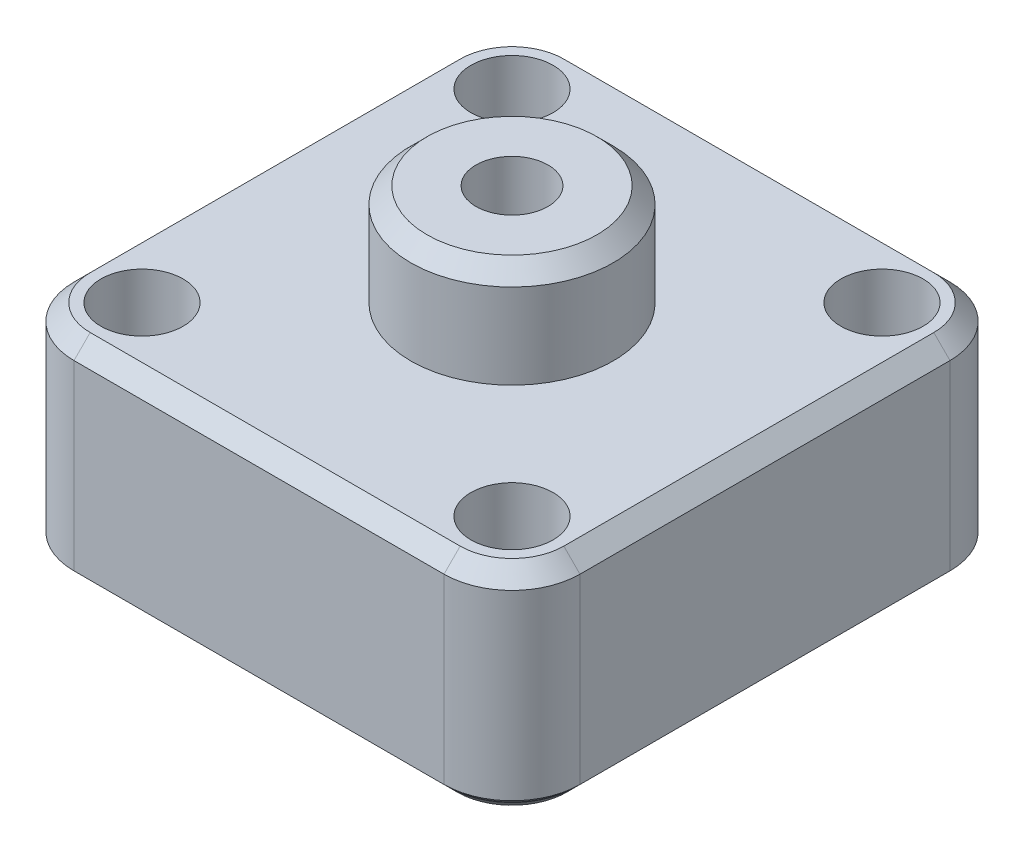
from build123d import *

# Parameters (mm, degrees)
SKETCH1_W             = 15.875
SKETCH1_H             = 15.875
BOSS_EXTRUDE1_DEPTH   = 9.525
F_5_40_TAPPED_HOLE1_D = 2.5781
SKETCH4_R             = 3.937
BOSS_EXTRUDE2_DEPTH   = 1.143
SKETCH10_R            = 1.9685
BOSS_EXTRUDE4_DEPTH   = 4.953
F_4_40_TAPPED_HOLE1_D = 2.2606
SKETCH9_OUTSIDE_W     = 23.345
SKETCH9_OUTSIDE_H     = 23.345
SKETCH9_OUTSIDE_R     = 3.175
CUT_EXTRUDE3_DEPTH    = 3.175
SKETCH11_OUTSIDE_W    = 23.345
SKETCH11_OUTSIDE_H    = 23.345
CUT_EXTRUDE4_DEPTH    = 15.721869362
CHAMFER1_SIZE         = 0.254
CHAMFER3_SIZE         = 0.508
CHAMFER4_SIZE         = 0.127


with BuildPart() as part:
    # Sketch1 → Boss-Extrude1 (new body)
    with BuildSketch(Plane(origin=(0, 0, 0), x_dir=(1, 0, 0), z_dir=(0, 1, 0))):
        Rectangle(SKETCH1_W, SKETCH1_H)
    extrude(amount=BOSS_EXTRUDE1_DEPTH)

    # #5-40 Tapped Hole1 (through all)
    with Locations(Plane(origin=(0, 0, 0), x_dir=(-1, 0, 0), z_dir=(0, -1, 0))):
        with Locations((-5.8039, -5.8039), (-5.8039, 5.8039), (5.8039, 5.8039), (5.8039, -5.8039)):
            Hole(F_5_40_TAPPED_HOLE1_D / 2)

    # Sketch4 → Boss-Extrude2 (add)
    with BuildSketch(Plane.XZ):
        with Locations(Location((0, 0, 0), (0, 0, 90))):
            Circle(SKETCH4_R)
    extrude(amount=BOSS_EXTRUDE2_DEPTH)

    # Sketch10 → Boss-Extrude4 (add)
    with BuildSketch(Plane.XZ.offset(1.143)):
        with Locations(Location((0, 0, 0), (0, 0, 90))):
            Circle(SKETCH10_R)
    extrude(amount=BOSS_EXTRUDE4_DEPTH)

    # #4-40 Tapped Hole1 (through all)
    with Locations(Plane(origin=(0, -6.096, 0), x_dir=(-1, 0, 0), z_dir=(0, -1, 0))):
        with Locations((0, 0)):
            Hole(F_4_40_TAPPED_HOLE1_D / 2)

    # Sketch9 outside → Cut-Extrude3 (cut)
    with BuildSketch(Plane(origin=(0, 9.525, 0), x_dir=(1, 0, 0), z_dir=(0, 1, 0))):
        with Locations((-0.0005, -0.0005)):
            Rectangle(SKETCH9_OUTSIDE_W, SKETCH9_OUTSIDE_H)
        with Locations(Location((0, 0, 0), (0, 0, 270))):
            Circle(SKETCH9_OUTSIDE_R, mode=Mode.SUBTRACT)
    extrude(amount=-CUT_EXTRUDE3_DEPTH, mode=Mode.SUBTRACT)

    # Sketch11 outside → Cut-Extrude4 (cut, through all)
    with BuildSketch(Plane.XZ):
        with Locations((-0.0005, 0.0005)):
            Rectangle(SKETCH11_OUTSIDE_W, SKETCH11_OUTSIDE_H)
        with BuildLine():
            Line((-5.8039, 7.9375), (5.8039, 7.9375))
            ThreePointArc((5.8039, 7.9375), (7.312583028, 7.312583028), (7.9375, 5.8039))
            Line((7.9375, 5.8039), (7.9375, -5.8039))
            ThreePointArc((7.9375, -5.8039), (7.312583028, -7.312583028), (5.8039, -7.9375))
            Line((5.8039, -7.9375), (-5.8039, -7.9375))
            ThreePointArc((-5.8039, -7.9375), (-7.312583028, -7.312583028), (-7.9375, -5.8039))
            Line((-7.9375, -5.8039), (-7.9375, 5.8039))
            ThreePointArc((-7.9375, 5.8039), (-7.312583028, 7.312583028), (-5.8039, 7.9375))
        make_face(mode=Mode.SUBTRACT)
    extrude(amount=-CUT_EXTRUDE4_DEPTH, mode=Mode.SUBTRACT)

    # Chamfer1
    chamfer1_edges = [part.edges().sort_by_distance(p)[0] for p in [
        (0, -1.143, -3.937),
        (0, -6.096, -1.9685),
    ]]
    chamfer(chamfer1_edges, length=CHAMFER1_SIZE)

    # Chamfer3
    chamfer3_edges = [part.edges().sort_by_distance(p)[0] for p in [
        (0, 9.525, -3.175),
        (7.9375, 6.35, 0),
        (0, 6.35, -7.9375),
        (-7.9375, 6.35, 0),
        (0, 6.35, 7.9375),
        (-7.312583028, 6.35, -7.312583028),
        (7.312583028, 6.35, -7.312583028),
        (7.312583028, 6.35, 7.312583028),
        (-7.312583028, 6.35, 7.312583028),
    ]]
    chamfer(chamfer3_edges, length=CHAMFER3_SIZE)

    # Chamfer4
    chamfer4_edges = [part.edges().sort_by_distance(p)[0] for p in [
        (-7.312583028, 0, 7.312583028),
        (7.312583028, 0, 7.312583028),
        (7.312583028, 0, -7.312583028),
        (-7.312583028, 0, -7.312583028),
        (7.9375, 0, 0),
        (0, 0, 7.9375),
        (-7.9375, 0, 0),
        (0, 0, -7.9375),
    ]]
    chamfer(chamfer4_edges, length=CHAMFER4_SIZE)


solid = part.part
